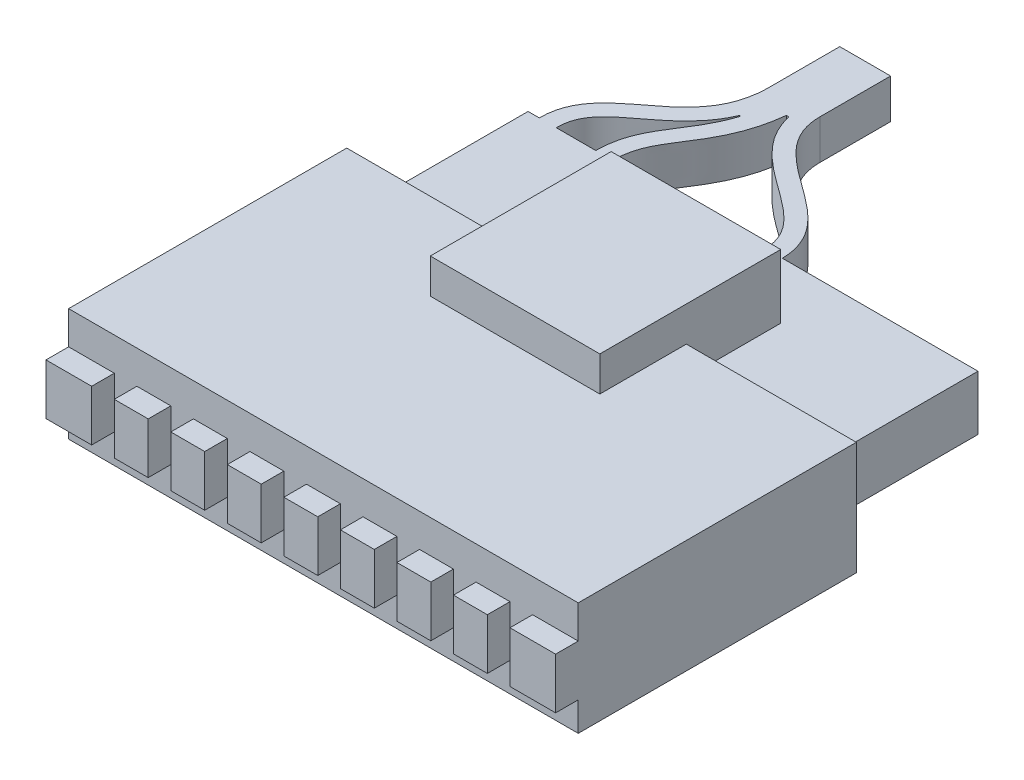
from build123d import *

# Parameters (mm, degrees)
SKETCH1_W           = 22.9
SKETCH1_H           = 12.4968
BOSS_EXTRUDE1_DEPTH = 5.08
SKETCH2_W           = 22.9
SKETCH2_H           = 2.286
BOSS_EXTRUDE2_DEPTH = 1.016
SKETCH3_W           = 1.016
SKETCH3_H           = 1.016
CUT_EXTRUDE1_DEPTH  = 27.577930887
SKETCH4_W           = 20.2184
SKETCH4_H           = 2.4638
BOSS_EXTRUDE3_DEPTH = 6.8072
SKETCH5_W           = 7.62
SKETCH5_H           = 8.128
BOSS_EXTRUDE4_DEPTH = 2.8702
BOSS_EXTRUDE6_DEPTH = 1.778


with BuildPart() as part:
    # Sketch1 → Boss-Extrude1 (new body)
    with BuildSketch(Plane(origin=(0, 0, 0), x_dir=(1, 0, 0), z_dir=(0, 1, 0))):
        with Locations((11.45, 6.2484)):
            Rectangle(SKETCH1_W, SKETCH1_H)
    extrude(amount=BOSS_EXTRUDE1_DEPTH)

    # Sketch2 → Boss-Extrude2 (add)
    with BuildSketch(Plane.XY):
        with Locations((11.45, 2.449418531)):
            Rectangle(SKETCH2_W, SKETCH2_H)
    extrude(amount=BOSS_EXTRUDE2_DEPTH)

    # Sketch3 → Cut-Extrude1 (cut, through all)
    with BuildSketch(Plane(origin=(0, 5.08, 0), x_dir=(1, 0, 0), z_dir=(0, 1, 0))):
        with Locations((2.56, -0.508)):
            Rectangle(SKETCH3_W, SKETCH3_H)
        with Locations((5.1, -0.508)):
            Rectangle(SKETCH3_W, SKETCH3_H)
        with Locations((7.64, -0.508)):
            Rectangle(SKETCH3_W, SKETCH3_H)
        with Locations((10.18, -0.508)):
            Rectangle(SKETCH3_W, SKETCH3_H)
        with Locations((12.72, -0.508)):
            Rectangle(SKETCH3_W, SKETCH3_H)
        with Locations((15.26, -0.508)):
            Rectangle(SKETCH3_W, SKETCH3_H)
        with Locations((17.8, -0.508)):
            Rectangle(SKETCH3_W, SKETCH3_H)
        with Locations((20.34, -0.508)):
            Rectangle(SKETCH3_W, SKETCH3_H)
    extrude(amount=-CUT_EXTRUDE1_DEPTH, mode=Mode.SUBTRACT)

    # Sketch4 → Boss-Extrude3 (add)
    with BuildSketch(Plane(origin=(0, 0, -12.4968), x_dir=(-1, 0, 0), z_dir=(0, 0, -1))):
        with Locations((-11.45, 2.54)):
            Rectangle(SKETCH4_W, SKETCH4_H)
    extrude(amount=BOSS_EXTRUDE3_DEPTH)

    # Sketch5 → Boss-Extrude4 (add)
    with BuildSketch(Plane(origin=(0, 3.7719, 0), x_dir=(1, 0, 0), z_dir=(0, 1, 0))):
        with Locations((11.45, 12.6746)):
            Rectangle(SKETCH5_W, SKETCH5_H)
    extrude(amount=BOSS_EXTRUDE4_DEPTH)

    # Sketch6 → Boss-Extrude6 (add)
    # profile 1 of 4: a face of its own
    with BuildSketch(Plane(origin=(0, 3.7719, 0), x_dir=(1, 0, 0), z_dir=(0, 1, 0))):
        with BuildLine():
            add(Edge.make_bspline(
                [(12.764837987, 19.304), (12.764837987, 19.513213272), (12.713813556, 19.940397022), (12.430473546, 20.689983513), (11.84369856, 21.434451274), (10.99868157, 22.128872758), (10.114149769, 22.755114216), (9.290977221, 23.379772734), (8.634141686, 24.039902479), (8.28695824, 24.637071385), (8.136269303, 25.170420647), (8.107573693, 25.497240703), (8.107573693, 25.654)],
                knots=[0, 0, 0, 0, 0.0625, 0.125, 0.25, 0.375, 0.5, 0.625, 0.75, 0.875, 0.9375, 1, 1, 1, 1], degree=3))
            Line((8.107573693, 25.654), (8.107573693, 28.829))
            Line((8.107573693, 28.829), (5.821803018, 28.829))
            Line((5.821803018, 28.829), (5.821803018, 25.672693301))
            add(Edge.make_bspline(
                [(1.842837987, 19.304), (1.842837987, 22.316040756), (5.821803018, 22.055802608), (5.821803018, 25.672693301)],
                knots=[0, 0, 0, 0, 1, 1, 1, 1], degree=3))
            Line((1.842837987, 19.304), (2.604837987, 19.304))
            add(Edge.make_bspline(
                [(2.604837987, 19.304), (2.604837987, 19.436184229), (2.628829628, 19.717403115), (2.748821923, 20.134038551), (3.017012948, 20.581214899), (3.561863063, 21.101594101), (4.28319589, 21.642805815), (5.083141911, 22.269605528), (5.750459382, 22.975833182), (6.10677757, 23.58043805), (6.230115453, 23.859247989), (6.250774433, 23.908581669)],
                knots=[0, 0, 0, 0, 0.0625, 0.125, 0.25, 0.375, 0.5, 0.625, 0.75, 0.824094442, 0.839719442, 0.839719442, 0.839719442, 0.839719442], degree=3))
            add(Edge.make_bspline(
                [(6.250774433, 23.908581669), (6.271433413, 23.95791535), (6.316227133, 24.071064885), (6.41779978, 24.365489751), (6.480855857, 24.623522586), (6.514810758, 24.824299603)],
                knots=[0.839719442, 0.839719442, 0.839719442, 0.839719442, 0.855344442, 0.875, 0.928476516, 0.928476516, 0.928476516, 0.928476516], degree=3))
            add(Edge.make_bspline(
                [(6.300749052, 23.880300217), (6.391194329, 24.164866019), (6.464932294, 24.476628676), (6.514810758, 24.824299603)],
                knots=[0.790040378, 0.790040378, 0.790040378, 0.790040378, 0.909912617, 0.909912617, 0.909912617, 0.909912617], degree=3))
            add(Edge.make_bspline(
                [(4.382837987, 19.304), (4.382837987, 21.310686016), (5.704652562, 22.004816166), (6.300749052, 23.880300217)],
                knots=[0, 0, 0, 0, 0.790040378, 0.790040378, 0.790040378, 0.790040378], degree=3))
            Line((4.382837987, 19.304), (5.144837987, 19.304))
            add(Edge.make_bspline(
                [(5.144837987, 19.304), (5.144837987, 19.427793819), (5.158559892, 19.685949652), (5.231289869, 20.113666624), (5.394061657, 20.587818607), (5.695490865, 21.140525626), (6.088197228, 21.743923542), (6.524741922, 22.447977177), (6.93514926, 23.302596179), (7.174536626, 24.122966736), (7.269542471, 24.705079276), (7.293215165, 24.899470513), (7.299029307, 24.951977964)],
                knots=[0, 0, 0, 0, 0.0625, 0.125, 0.25, 0.375, 0.5, 0.625, 0.75, 0.875, 0.918103341, 0.933728341, 0.933728341, 0.933728341, 0.933728341], degree=3))
            add(Edge.make_bspline(
                [(7.299029307, 24.951977964), (7.304843448, 25.004485416), (7.327450173, 25.230534496), (7.341165481, 25.474360975), (7.345573693, 25.654)],
                knots=[0.933728341, 0.933728341, 0.933728341, 0.933728341, 0.949353341, 1, 1, 1, 1], degree=3))
            add(Edge.make_bspline(
                [(7.417250324, 24.951977964), (7.370695979, 25.171529954), (7.345573693, 25.404885005), (7.345573693, 25.654)],
                knots=[0.926554678, 0.926554678, 0.926554678, 0.926554678, 1, 1, 1, 1], degree=3))
            add(Edge.make_bspline(
                [(12.002837987, 19.304), (12.002837987, 21.609223862), (8.004559962, 22.182204254), (7.417250324, 24.951977964)],
                knots=[0, 0, 0, 0, 0.926554678, 0.926554678, 0.926554678, 0.926554678], degree=3))
            Line((12.002837987, 19.304), (12.764837987, 19.304))
        make_face()
        with BuildLine():
            add(Edge.make_bspline(
                [(6.514810758, 24.824299603), (6.520540217, 24.858178177), (6.563211161, 25.129441995), (6.583803018, 25.423501077), (6.583803018, 25.672693301)],
                knots=[0.928476516, 0.928476516, 0.928476516, 0.928476516, 0.9375, 1, 1, 1, 1], degree=3))
            add(Edge.make_bspline(
                [(6.514810758, 24.824299603), (6.552295837, 25.08558415), (6.576305195, 25.367149502), (6.583803018, 25.672693301)],
                knots=[0.909912617, 0.909912617, 0.909912617, 0.909912617, 1, 1, 1, 1], degree=3))
        make_face(mode=Mode.SUBTRACT)
    # profile 2 of 4: a face of its own
    with BuildSketch(Plane(origin=(0, 3.7719, 0), x_dir=(1, 0, 0), z_dir=(0, 1, 0))):
        with BuildLine():
            Line((7.299029307, 24.951977964), (7.417250324, 24.951977964))
            add(Edge.make_bspline(
                [(7.417250324, 24.951977964), (7.370695979, 25.171529954), (7.345573693, 25.404885005), (7.345573693, 25.654)],
                knots=[0.926554678, 0.926554678, 0.926554678, 0.926554678, 1, 1, 1, 1], degree=3))
            add(Edge.make_bspline(
                [(7.299029307, 24.951977964), (7.304843448, 25.004485416), (7.327450173, 25.230534496), (7.341165481, 25.474360975), (7.345573693, 25.654)],
                knots=[0.933728341, 0.933728341, 0.933728341, 0.933728341, 0.949353341, 1, 1, 1, 1], degree=3))
        make_face()
    # profile 3 of 4: a face of its own
    with BuildSketch(Plane(origin=(0, 3.7719, 0), x_dir=(1, 0, 0), z_dir=(0, 1, 0))):
        with BuildLine():
            Line((6.250774433, 23.908581669), (6.300749052, 23.880300217))
            add(Edge.make_bspline(
                [(6.300749052, 23.880300217), (6.391194329, 24.164866019), (6.464932294, 24.476628676), (6.514810758, 24.824299603)],
                knots=[0.790040378, 0.790040378, 0.790040378, 0.790040378, 0.909912617, 0.909912617, 0.909912617, 0.909912617], degree=3))
            add(Edge.make_bspline(
                [(6.250774433, 23.908581669), (6.271433413, 23.95791535), (6.316227133, 24.071064885), (6.41779978, 24.365489751), (6.480855857, 24.623522586), (6.514810758, 24.824299603)],
                knots=[0.839719442, 0.839719442, 0.839719442, 0.839719442, 0.855344442, 0.875, 0.928476516, 0.928476516, 0.928476516, 0.928476516], degree=3))
        make_face()
    # profile 4 of 4: a face of its own
    with BuildSketch(Plane(origin=(0, 3.7719, 0), x_dir=(1, 0, 0), z_dir=(0, 1, 0))):
        with BuildLine():
            add(Edge.make_bspline(
                [(6.514810758, 24.824299603), (6.552295837, 25.08558415), (6.576305195, 25.367149502), (6.583803018, 25.672693301)],
                knots=[0.909912617, 0.909912617, 0.909912617, 0.909912617, 1, 1, 1, 1], degree=3))
            add(Edge.make_bspline(
                [(6.514810758, 24.824299603), (6.520540217, 24.858178177), (6.563211161, 25.129441995), (6.583803018, 25.423501077), (6.583803018, 25.672693301)],
                knots=[0.928476516, 0.928476516, 0.928476516, 0.928476516, 0.9375, 1, 1, 1, 1], degree=3))
        make_face()
    extrude(amount=-BOSS_EXTRUDE6_DEPTH)


solid = part.part
